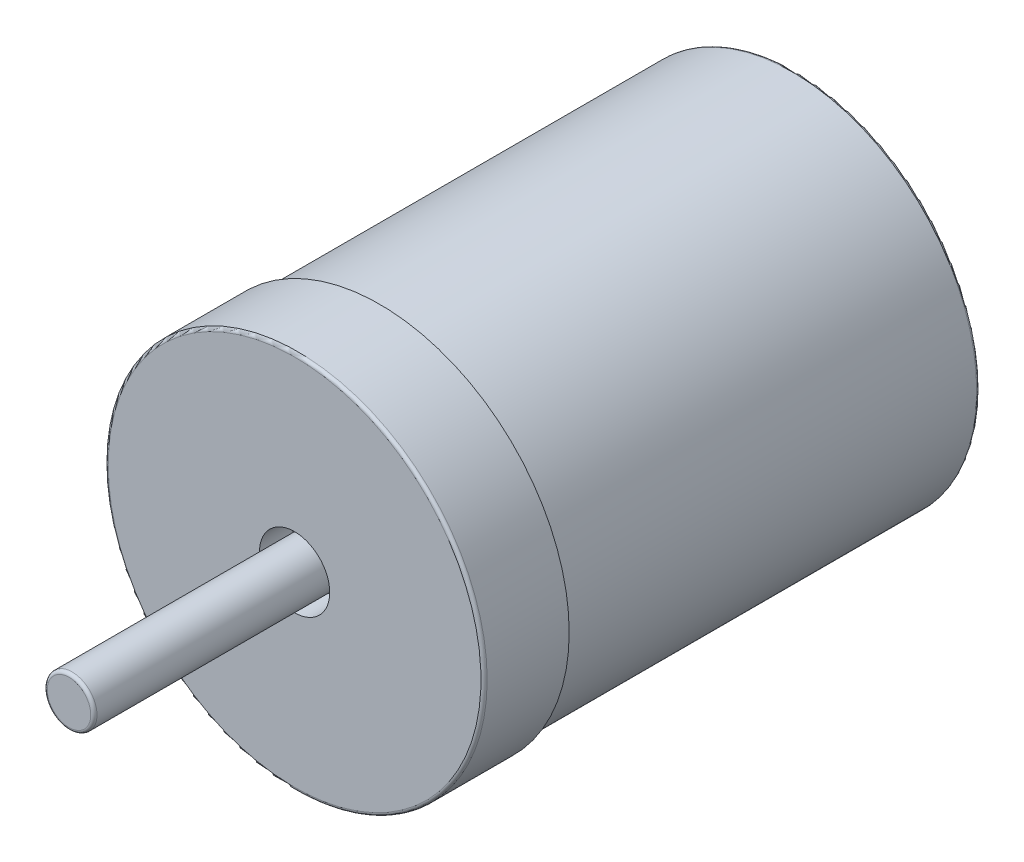
from build123d import *

# Parameters (mm, degrees)
FILLET2_R = 0.5


with BuildPart() as part:
    # Sketch1 → Revolve1 (revolve)
    with BuildSketch(Plane(origin=(0, 0, 0), x_dir=(0, 0, -1), z_dir=(1, 0, 0)), mode=Mode.PRIVATE) as revolve1_sk:
        Polygon((13.7, 30.5), (13.7, 29.597484089), (80.7, 29.597484089), (80.7, 11.585161601), (88.164497018, 11.585161601), (88.164497018, 4), (90.391404279, 4), (90.391404279, 0), (-36.308595721, 0), (-36.308595721, 4), (5.413824797, 4), (5.413824797, 5.652900668), (0, 5.652900668), (0, 30.5), align=None)
    revolve(revolve1_sk.sketch.rotate(Axis((0, 0, 36.308595721), (0, 0, -1)), 90), axis=Axis((0, 0, 36.308595721), (0, 0, -1)))

    # Fillet2
    fillet2_edges = [part.edges().sort_by_distance(p)[0] for p in [
        (-4, 0, 36.308595721),
        (-4, 0, -90.391404279),
        (-29.597484089, 0, -80.7),
        (-30.5, 0, 0),
    ]]
    fillet(fillet2_edges, radius=FILLET2_R)


solid = part.part
